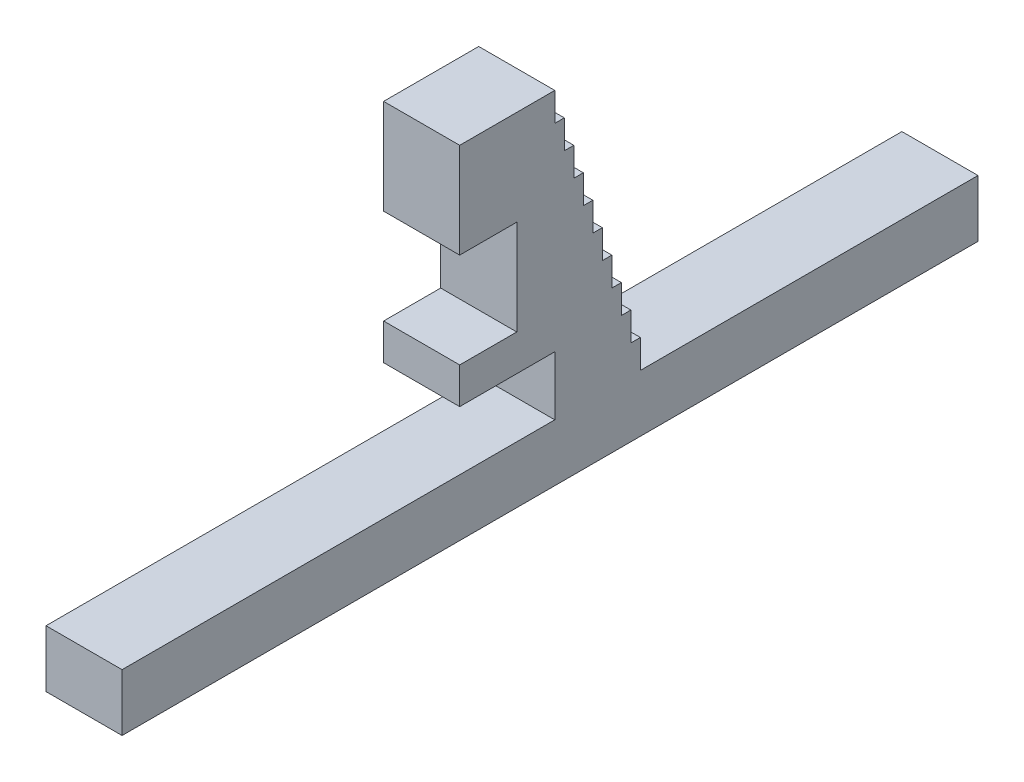
from build123d import *

# Parameters (mm, degrees)
BOSS_EXTRUDE1_DEPTH = 4


with BuildPart() as part:
    # Sketch1 → Boss-Extrude1 (new body)
    with BuildSketch(Plane(origin=(0, 0, 0), x_dir=(0, 0, -1), z_dir=(1, 0, 0))):
        Polygon((4, 0), (21.75, 0), (21.75, -3), (-23.25, -3), (-23.25, 0), (-5.5, 0), (-0.5, 0), (-0.5, 3.1), (-5.5, 3.1), (-5.5, 5), (-2.5, 5), (-2.5, 10), (-5.5, 10), (-5.5, 15), (-0.5, 15), (-0.5, 13.5), (0, 13.5), (0, 12), (0.5, 12), (0.5, 10.5), (1, 10.5), (1, 9), (1.5, 9), (1.5, 7.5), (2, 7.5), (2, 6), (2.5, 6), (2.5, 4.5), (3, 4.5), (3, 3), (3.5, 3), (3.5, 1.5), (4, 1.5), align=None)
    extrude(amount=BOSS_EXTRUDE1_DEPTH)


solid = part.part
